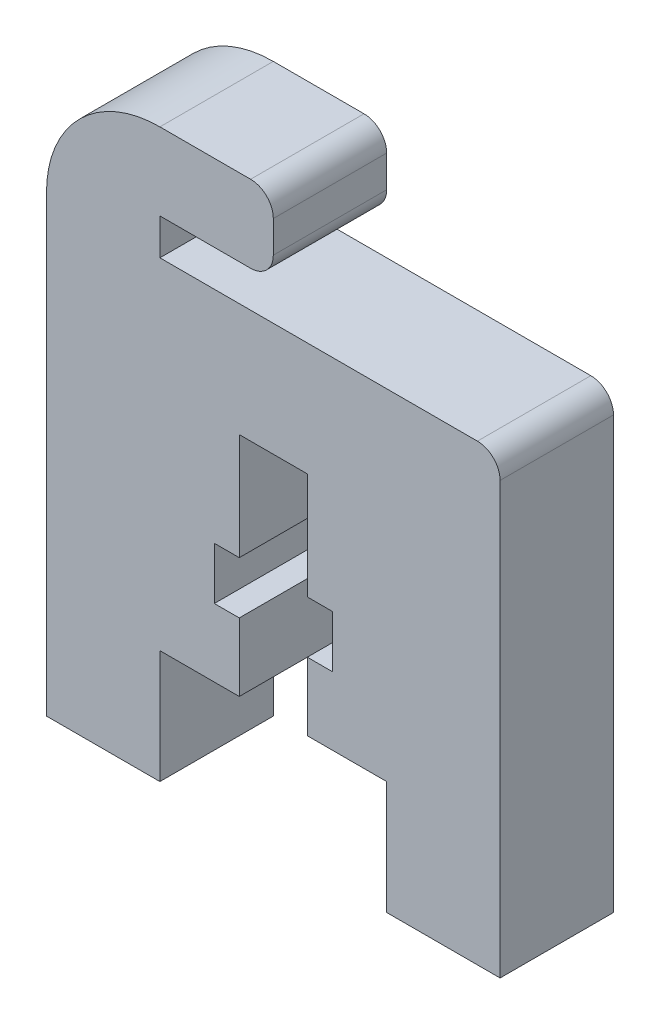
from build123d import *

# Parameters (mm, degrees)
BOSS_EXTRUDE1_DEPTH = 5
FILLET1_R           = 5
FILLET3_R           = 1
FILLET4_R           = 1


with BuildPart() as part:
    # Sketch1 → Boss-Extrude1 (new body)
    with BuildSketch(Plane.XY):
        Polygon((0, 5), (0, 19.982808697), (0, 25), (10, 25), (10, 21.6), (5, 21.6), (5, 20), (20, 20), (20, 5), (20, 0), (15, 0), (15, 5), (11.5, 5), (11.5, 8), (12.6, 8), (12.6, 10.3), (11.5, 10.3), (11.5, 15), (8.5, 15), (8.5, 10.3), (7.4, 10.3), (7.4, 8), (8.5, 8), (8.5, 5), (5, 5), (5, 0), (0, 0), align=None)
    extrude(amount=BOSS_EXTRUDE1_DEPTH)

    # Fillet1
    fillet1_edges = [part.edges().sort_by_distance(p)[0] for p in [
        (0, 25, 2.5),
    ]]
    fillet(fillet1_edges, radius=FILLET1_R)

    # Fillet3
    fillet3_edges = [part.edges().sort_by_distance(p)[0] for p in [
        (10, 21.6, 2.5),
        (20, 20, 2.5),
    ]]
    fillet(fillet3_edges, radius=FILLET3_R)

    # Fillet4
    fillet4_edges = [part.edges().sort_by_distance(p)[0] for p in [
        (10, 25, 2.5),
    ]]
    fillet(fillet4_edges, radius=FILLET4_R)


solid = part.part
